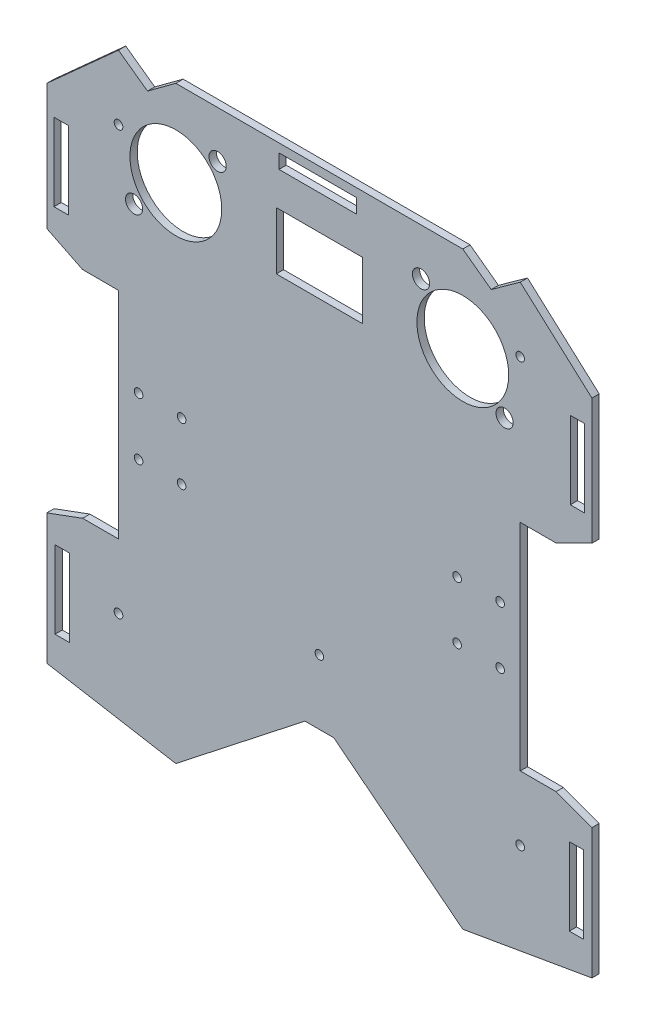
from build123d import *

# Parameters (mm, degrees)
MODEL_W             = 0.196666719
MODEL_H             = 1.063333355
MODEL_R             = 0.059734003
MODEL_R_2           = 0.059132363
MODEL_R_3           = 0.058700681
MODEL_R_4           = 0.059278631
MODEL_W_2           = 0.198333417
MODEL_H_2           = 1.063332875
MODEL_R_5           = 0.117771094
MODEL_R_6           = 0.059308134
MODEL_R_7           = 0.629776797
MODEL_W_3           = 1.181666698
MODEL_H_3           = 0.788333261
MODEL_R_8           = 0.118273295
MODEL_W_4           = 1.06333351
MODEL_H_4           = 0.196666719
MODEL_W_5           = 0.196666718
MODEL_R_9           = 0.058837572
BOSS_EXTRUDE2_DEPTH = 0.1


with BuildPart() as part:
    # Model → Boss-Extrude2 (new body)
    with BuildSketch(Plane.XY):
        Polygon((8.243333021, 10.81500034), (8.73499949, 11.05833383), (8.73499949, 12.783333892), (7.751666542, 13.668334122), (7.353333302, 13.381667257), (6.963333125, 13.668333653), (3.026666479, 13.668333653), (2.63833299, 13.381667257), (2.239999688, 13.668334122), (1.256666333, 12.783333892), (1.256666333, 11.05833383), (1.745516576, 10.816394548), (2.23999976, 10.81500034), (2.239999604, 7.861666955), (1.748333052, 7.861667122), (1.256666333, 7.680000507), (1.256666333, 6.976667205), (1.256666333, 5.893333872), (3.026666313, 5.586667184), (4.798333, 6.976667205), (5.193333135, 6.976667205), (6.963333281, 5.586667184), (8.73499949, 5.893333872), (8.73499949, 6.976667205), (8.73499949, 7.680000507), (8.243333021, 7.861667122), (7.751666458, 7.861666955), (7.751666458, 8.851667372), (7.751666458, 9.825000726), (7.751666458, 10.81500033), align=None)
        with Locations((1.468333079, 6.826667195)):
            Rectangle(MODEL_W, MODEL_H, mode=Mode.SUBTRACT)
        with Locations((2.240266314, 6.976936858)):
            Circle(MODEL_R, mode=Mode.SUBTRACT)
        with Locations((2.515867534, 8.944828144)):
            Circle(MODEL_R_2, mode=Mode.SUBTRACT)
        with Locations((4.996310649, 7.8628457)):
            Circle(MODEL_R_3, mode=Mode.SUBTRACT)
        with Locations((3.105723982, 8.944391158)):
            Circle(MODEL_R_4, mode=Mode.SUBTRACT)
        with Locations((7.75072444, 6.976057752)):
            Circle(MODEL_R_4, mode=Mode.SUBTRACT)
        with Locations((8.523333068, 6.826667195)):
            Rectangle(MODEL_W, MODEL_H, mode=Mode.SUBTRACT)
        with Locations((6.88586742, 8.944828144)):
            Circle(MODEL_R_2, mode=Mode.SUBTRACT)
        with Locations((7.475867576, 8.944828144)):
            Circle(MODEL_R_2, mode=Mode.SUBTRACT)
        with Locations((2.515867534, 9.731494696)):
            Circle(MODEL_R_2, mode=Mode.SUBTRACT)
        with Locations((3.105723982, 9.73105771)):
            Circle(MODEL_R_4, mode=Mode.SUBTRACT)
        with Locations((1.454166407, 11.89833383)):
            Rectangle(MODEL_W_2, MODEL_H_2, mode=Mode.SUBTRACT)
        with Locations((2.453895151, 11.948297187)):
            Circle(MODEL_R_5, mode=Mode.SUBTRACT)
        with Locations((2.24069159, 12.783291009)):
            Circle(MODEL_R_6, mode=Mode.SUBTRACT)
        with Locations((3.026889474, 12.486656436)):
            Circle(MODEL_R_7, mode=Mode.SUBTRACT)
        with Locations((4.995833234, 12.487500794)):
            Rectangle(MODEL_W_3, MODEL_H_3, mode=Mode.SUBTRACT)
        with Locations((3.600060926, 13.027254837)):
            Circle(MODEL_R_8, mode=Mode.SUBTRACT)
        with Locations((4.97333288, 13.451667117)):
            Rectangle(MODEL_W_4, MODEL_H_4, mode=Mode.SUBTRACT)
        with Locations((6.88586742, 9.731494696)):
            Circle(MODEL_R_2, mode=Mode.SUBTRACT)
        with Locations((7.475867576, 9.731494696)):
            Circle(MODEL_R_2, mode=Mode.SUBTRACT)
        with Locations((6.963555964, 12.486656436)):
            Circle(MODEL_R_7, mode=Mode.SUBTRACT)
        with Locations((6.390061207, 13.027254837)):
            Circle(MODEL_R_8, mode=Mode.SUBTRACT)
        with Locations((7.537228797, 11.948297187)):
            Circle(MODEL_R_5, mode=Mode.SUBTRACT)
        with Locations((8.536666703, 11.89833383)):
            Rectangle(MODEL_W_5, MODEL_H_2, mode=Mode.SUBTRACT)
        with Locations((7.751169616, 12.782410364)):
            Circle(MODEL_R_9, mode=Mode.SUBTRACT)
    extrude(amount=BOSS_EXTRUDE2_DEPTH)


solid = part.part
